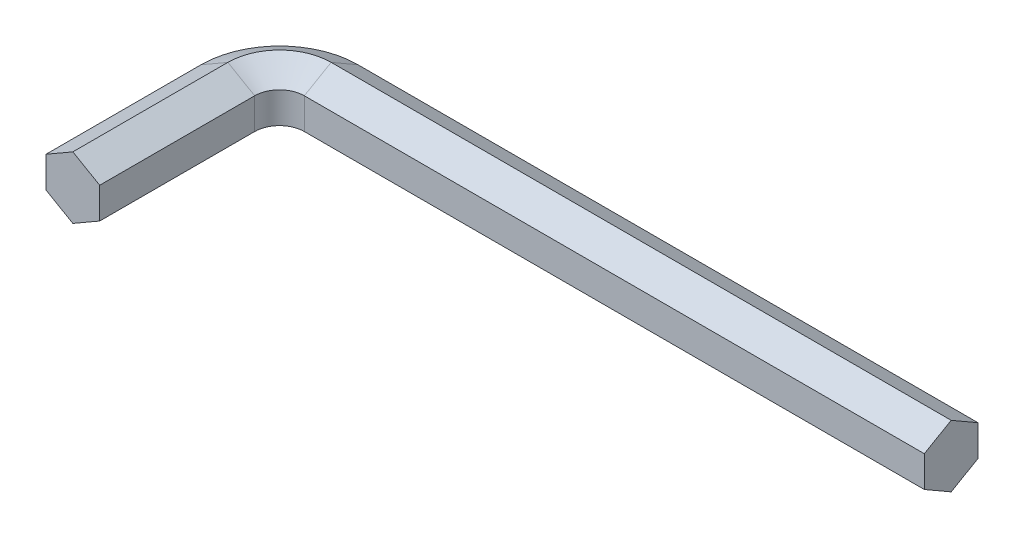
from build123d import *


with BuildPart() as part:
    # Sweep1: sweep along a path in Sketch1
    with BuildLine(Plane(origin=(0, 0, 0), x_dir=(1, 0, 0), z_dir=(0, 1, 0))) as sweep1_path:
        Line((-9.487179487, -11.794871795), (-9.487179487, 3.205128205))
        ThreePointArc((-9.487179487, 3.205128205), (-8.022713393, 6.740662111), (-4.487179487, 8.205128205))
        Line((-4.487179487, 8.205128205), (55.512820513, 8.205128205))
    # Sketch2 → Sweep1 (sweep)
    with BuildSketch(Plane(origin=(55.512820513, 0, 0), x_dir=(0, 0, -1), z_dir=(1, 0, 0))):
        Polygon((5.607051994, 1.5), (5.607051994, -1.5), (8.205128205, -3), (10.803204416, -1.5), (10.803204416, 1.5), (8.205128205, 3), align=None)
    sweep(path=sweep1_path.line)


solid = part.part
